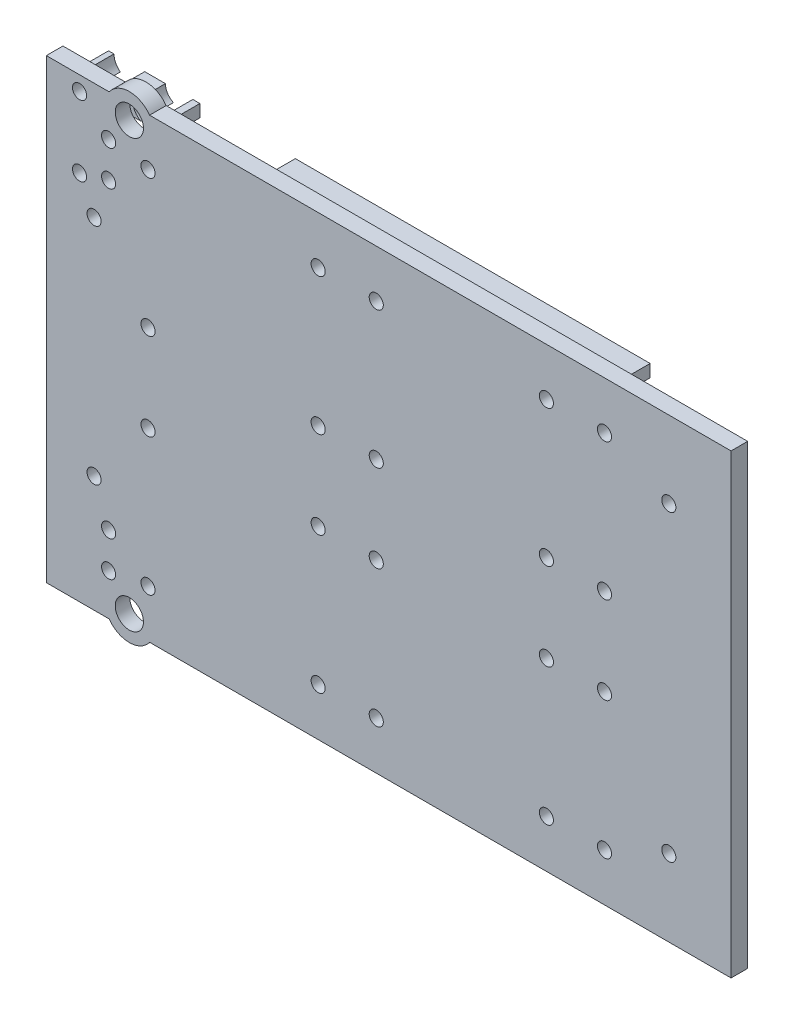
from build123d import *

# Parameters (mm, degrees)
MAIN_PROFILE_SKETCH_R       = 3.4
MAIN_PROFILE_SKETCH_R_2     = 1.7
MAIN_EXTRUSION_DEPTH        = 3.5
DETAIL_PROFILE_2_SKETCH_R   = 5.3
DETAIL_PROFILE_2_SKETCH_R_2 = 1.7
DETAIL_EXTRUSION_2_DEPTH    = 0.5
DETAIL_PROFILE_3_SKETCH_W   = 85.5
DETAIL_PROFILE_3_SKETCH_H   = 3
DETAIL_EXTRUSION_3_DEPTH    = 0.2
DETAIL_PROFILE_4_SKETCH_W   = 85.5
DETAIL_PROFILE_4_SKETCH_H   = 3
DETAIL_EXTRUSION_4_DEPTH    = 7.8


with BuildPart() as part:
    # Main Profile Sketch → Main Extrusion (new body)
    with BuildSketch(Plane.XY.offset(48.5)):
        with BuildLine():
            Line((-85.126602828, 55), (55, 55))
            Line((55, 55), (55, -55))
            Line((55, -55), (-85.126602828, -55))
            ThreePointArc((-85.126602828, -55), (-90, -57.5), (-94.873397172, -55))
            Line((-94.873397172, -55), (-110, -55))
            Line((-110, -55), (-110, 55))
            Line((-110, 55), (-94.873397172, 55))
            ThreePointArc((-94.873397172, 55), (-90, 57.5), (-85.126602828, 55))
        make_face()
        with Locations((-90, -51.5)):
            Circle(MAIN_PROFILE_SKETCH_R, mode=Mode.SUBTRACT)
        with Locations((-95, -45)):
            Circle(MAIN_PROFILE_SKETCH_R_2, mode=Mode.SUBTRACT)
        with Locations((-85.5, -43.5)):
            Circle(MAIN_PROFILE_SKETCH_R_2, mode=Mode.SUBTRACT)
        with Locations((-95, -36.5)):
            Circle(MAIN_PROFILE_SKETCH_R_2, mode=Mode.SUBTRACT)
        with Locations((-44.5, -43.5)):
            Circle(MAIN_PROFILE_SKETCH_R_2, mode=Mode.SUBTRACT)
        with Locations((-30.5, -43.5)):
            Circle(MAIN_PROFILE_SKETCH_R_2, mode=Mode.SUBTRACT)
        with Locations((-98.5, -27)):
            Circle(MAIN_PROFILE_SKETCH_R_2, mode=Mode.SUBTRACT)
        with Locations((-85.5, -10.5)):
            Circle(MAIN_PROFILE_SKETCH_R_2, mode=Mode.SUBTRACT)
        with Locations((-44.5, -10.5)):
            Circle(MAIN_PROFILE_SKETCH_R_2, mode=Mode.SUBTRACT)
        with Locations((-30.5, -10.5)):
            Circle(MAIN_PROFILE_SKETCH_R_2, mode=Mode.SUBTRACT)
        with Locations((10.5, -43.5)):
            Circle(MAIN_PROFILE_SKETCH_R_2, mode=Mode.SUBTRACT)
        with Locations((24.5, -43.5)):
            Circle(MAIN_PROFILE_SKETCH_R_2, mode=Mode.SUBTRACT)
        with Locations((40, -36.5)):
            Circle(MAIN_PROFILE_SKETCH_R_2, mode=Mode.SUBTRACT)
        with Locations((10.5, -10.5)):
            Circle(MAIN_PROFILE_SKETCH_R_2, mode=Mode.SUBTRACT)
        with Locations((24.5, -10.5)):
            Circle(MAIN_PROFILE_SKETCH_R_2, mode=Mode.SUBTRACT)
        with Locations((-85.5, 10.5)):
            Circle(MAIN_PROFILE_SKETCH_R_2, mode=Mode.SUBTRACT)
        with Locations((-98.5, 27)):
            Circle(MAIN_PROFILE_SKETCH_R_2, mode=Mode.SUBTRACT)
        with Locations((-44.5, 10.5)):
            Circle(MAIN_PROFILE_SKETCH_R_2, mode=Mode.SUBTRACT)
        with Locations((-30.5, 10.5)):
            Circle(MAIN_PROFILE_SKETCH_R_2, mode=Mode.SUBTRACT)
        with Locations((-102, 34.5)):
            Circle(MAIN_PROFILE_SKETCH_R_2, mode=Mode.SUBTRACT)
        with Locations((-95, 36.5)):
            Circle(MAIN_PROFILE_SKETCH_R_2, mode=Mode.SUBTRACT)
        with Locations((-95, 45)):
            Circle(MAIN_PROFILE_SKETCH_R_2, mode=Mode.SUBTRACT)
        with Locations((-102, 51.5)):
            Circle(MAIN_PROFILE_SKETCH_R_2, mode=Mode.SUBTRACT)
        with Locations((-90, 51.5)):
            Circle(MAIN_PROFILE_SKETCH_R, mode=Mode.SUBTRACT)
        with Locations((-85.5, 43.5)):
            Circle(MAIN_PROFILE_SKETCH_R_2, mode=Mode.SUBTRACT)
        with Locations((-44.5, 43.5)):
            Circle(MAIN_PROFILE_SKETCH_R_2, mode=Mode.SUBTRACT)
        with Locations((-30.5, 43.5)):
            Circle(MAIN_PROFILE_SKETCH_R_2, mode=Mode.SUBTRACT)
        with Locations((10.5, 10.5)):
            Circle(MAIN_PROFILE_SKETCH_R_2, mode=Mode.SUBTRACT)
        with Locations((24.5, 10.5)):
            Circle(MAIN_PROFILE_SKETCH_R_2, mode=Mode.SUBTRACT)
        with Locations((10.5, 43.5)):
            Circle(MAIN_PROFILE_SKETCH_R_2, mode=Mode.SUBTRACT)
        with Locations((40, 36.5)):
            Circle(MAIN_PROFILE_SKETCH_R_2, mode=Mode.SUBTRACT)
        with Locations((24.5, 43.5)):
            Circle(MAIN_PROFILE_SKETCH_R_2, mode=Mode.SUBTRACT)
    extrude(amount=-MAIN_EXTRUSION_DEPTH)

    # Detail Profile 2 Sketch → Detail Extrusion 2 (add)
    with BuildSketch(Plane.XY.offset(45)):
        with BuildLine():
            Line((-85.126602828, 55), (55, 55))
            Line((55, 55), (55, -55))
            Line((55, -55), (-85.126602828, -55))
            ThreePointArc((-85.126602828, -55), (-90, -57.5), (-94.873397172, -55))
            Line((-94.873397172, -55), (-110, -55))
            Line((-110, -55), (-110, 55))
            Line((-110, 55), (-94.873397172, 55))
            ThreePointArc((-94.873397172, 55), (-90, 57.5), (-85.126602828, 55))
        make_face()
        with Locations((-90, -51.5)):
            Circle(DETAIL_PROFILE_2_SKETCH_R, mode=Mode.SUBTRACT)
        with Locations((-95, -45)):
            Circle(DETAIL_PROFILE_2_SKETCH_R_2, mode=Mode.SUBTRACT)
        with Locations((-85.5, -43.5)):
            Circle(DETAIL_PROFILE_2_SKETCH_R_2, mode=Mode.SUBTRACT)
        with Locations((-95, -36.5)):
            Circle(DETAIL_PROFILE_2_SKETCH_R_2, mode=Mode.SUBTRACT)
        with Locations((-44.5, -43.5)):
            Circle(DETAIL_PROFILE_2_SKETCH_R_2, mode=Mode.SUBTRACT)
        with Locations((-30.5, -43.5)):
            Circle(DETAIL_PROFILE_2_SKETCH_R_2, mode=Mode.SUBTRACT)
        with Locations((-98.5, -27)):
            Circle(DETAIL_PROFILE_2_SKETCH_R_2, mode=Mode.SUBTRACT)
        with Locations((-85.5, -10.5)):
            Circle(DETAIL_PROFILE_2_SKETCH_R_2, mode=Mode.SUBTRACT)
        with Locations((-44.5, -10.5)):
            Circle(DETAIL_PROFILE_2_SKETCH_R_2, mode=Mode.SUBTRACT)
        with Locations((-30.5, -10.5)):
            Circle(DETAIL_PROFILE_2_SKETCH_R_2, mode=Mode.SUBTRACT)
        with Locations((10.5, -43.5)):
            Circle(DETAIL_PROFILE_2_SKETCH_R_2, mode=Mode.SUBTRACT)
        with Locations((24.5, -43.5)):
            Circle(DETAIL_PROFILE_2_SKETCH_R_2, mode=Mode.SUBTRACT)
        with Locations((40, -36.5)):
            Circle(DETAIL_PROFILE_2_SKETCH_R_2, mode=Mode.SUBTRACT)
        with Locations((10.5, -10.5)):
            Circle(DETAIL_PROFILE_2_SKETCH_R_2, mode=Mode.SUBTRACT)
        with Locations((24.5, -10.5)):
            Circle(DETAIL_PROFILE_2_SKETCH_R_2, mode=Mode.SUBTRACT)
        with Locations((-85.5, 10.5)):
            Circle(DETAIL_PROFILE_2_SKETCH_R_2, mode=Mode.SUBTRACT)
        with Locations((-98.5, 27)):
            Circle(DETAIL_PROFILE_2_SKETCH_R_2, mode=Mode.SUBTRACT)
        with Locations((-44.5, 10.5)):
            Circle(DETAIL_PROFILE_2_SKETCH_R_2, mode=Mode.SUBTRACT)
        with Locations((-30.5, 10.5)):
            Circle(DETAIL_PROFILE_2_SKETCH_R_2, mode=Mode.SUBTRACT)
        with Locations((-102, 34.5)):
            Circle(DETAIL_PROFILE_2_SKETCH_R_2, mode=Mode.SUBTRACT)
        with Locations((-95, 36.5)):
            Circle(DETAIL_PROFILE_2_SKETCH_R_2, mode=Mode.SUBTRACT)
        with Locations((-95, 45)):
            Circle(DETAIL_PROFILE_2_SKETCH_R_2, mode=Mode.SUBTRACT)
        with Locations((-102, 51.5)):
            Circle(DETAIL_PROFILE_2_SKETCH_R_2, mode=Mode.SUBTRACT)
        with Locations((-90, 51.5)):
            Circle(DETAIL_PROFILE_2_SKETCH_R, mode=Mode.SUBTRACT)
        with Locations((-85.5, 43.5)):
            Circle(DETAIL_PROFILE_2_SKETCH_R_2, mode=Mode.SUBTRACT)
        with Locations((-44.5, 43.5)):
            Circle(DETAIL_PROFILE_2_SKETCH_R_2, mode=Mode.SUBTRACT)
        with Locations((-30.5, 43.5)):
            Circle(DETAIL_PROFILE_2_SKETCH_R_2, mode=Mode.SUBTRACT)
        with Locations((10.5, 10.5)):
            Circle(DETAIL_PROFILE_2_SKETCH_R_2, mode=Mode.SUBTRACT)
        with Locations((24.5, 10.5)):
            Circle(DETAIL_PROFILE_2_SKETCH_R_2, mode=Mode.SUBTRACT)
        with Locations((10.5, 43.5)):
            Circle(DETAIL_PROFILE_2_SKETCH_R_2, mode=Mode.SUBTRACT)
        with Locations((40, 36.5)):
            Circle(DETAIL_PROFILE_2_SKETCH_R_2, mode=Mode.SUBTRACT)
        with Locations((24.5, 43.5)):
            Circle(DETAIL_PROFILE_2_SKETCH_R_2, mode=Mode.SUBTRACT)
    extrude(amount=-DETAIL_EXTRUSION_2_DEPTH)

    # Detail Profile 3 Sketch → Detail Extrusion 3 (add)
    with BuildSketch(Plane.XY.offset(44.5)):
        with BuildLine():
            Line((-107, -48.5), (-94.369210455, -48.5))
            ThreePointArc((-94.369210455, -48.5), (-95.061956905, -49.929461145), (-95.3, -51.5))
            Line((-95.3, -51.5), (-107, -51.5))
            Line((-107, -51.5), (-107, -48.5))
        make_face()
        with BuildLine():
            Line((-85.630789545, -48.5), (-85, -48.5))
            Line((-85, -48.5), (-85, -49.742160417))
            ThreePointArc((-85, -49.742160417), (-85.274403026, -49.100263923), (-85.630789545, -48.5))
        make_face()
        with Locations((-19.25, -50)):
            Rectangle(DETAIL_PROFILE_3_SKETCH_W, DETAIL_PROFILE_3_SKETCH_H)
        with BuildLine():
            Line((-107, 51.5), (-105.7, 51.5))
            ThreePointArc((-105.7, 51.5), (-105.294151704, 49.81519599), (-104.165640783, 48.5))
            Line((-104.165640783, 48.5), (-107, 48.5))
            Line((-107, 48.5), (-107, 51.5))
        make_face()
        with BuildLine():
            Line((-98.3, 51.5), (-95.3, 51.5))
            ThreePointArc((-95.3, 51.5), (-95.061956905, 49.929461145), (-94.369210455, 48.5))
            Line((-94.369210455, 48.5), (-99.834359217, 48.5))
            ThreePointArc((-99.834359217, 48.5), (-98.705848296, 49.81519599), (-98.3, 51.5))
        make_face()
        with BuildLine():
            Line((-85, 49.742160417), (-85, 48.5))
            Line((-85, 48.5), (-85.630789545, 48.5))
            ThreePointArc((-85.630789545, 48.5), (-85.274403026, 49.100263923), (-85, 49.742160417))
        make_face()
        with Locations((-19.25, 50)):
            Rectangle(DETAIL_PROFILE_3_SKETCH_W, DETAIL_PROFILE_3_SKETCH_H)
    extrude(amount=-DETAIL_EXTRUSION_3_DEPTH)

    # Detail Profile 4 Sketch → Detail Extrusion 4 (add)
    with BuildSketch(Plane.XY.offset(44.3)):
        with BuildLine():
            Line((-107, -48.5), (-91.374772708, -48.5))
            ThreePointArc((-91.374772708, -48.5), (-92.777296342, -49.717691096), (-93.3, -51.5))
            Line((-93.3, -51.5), (-107, -51.5))
            Line((-107, -51.5), (-107, -48.5))
        make_face()
        with BuildLine():
            Line((-85, -48.5), (-85, -51.5))
            Line((-85, -51.5), (-86.7, -51.5))
            ThreePointArc((-86.7, -51.5), (-87.222703658, -49.717691096), (-88.625227292, -48.5))
            Line((-88.625227292, -48.5), (-85, -48.5))
        make_face()
        with Locations((-19.25, -50)):
            Rectangle(DETAIL_PROFILE_4_SKETCH_W, DETAIL_PROFILE_4_SKETCH_H)
        with BuildLine():
            Line((-107, 51.5), (-105.7, 51.5))
            ThreePointArc((-105.7, 51.5), (-105.294151704, 49.81519599), (-104.165640783, 48.5))
            Line((-104.165640783, 48.5), (-107, 48.5))
            Line((-107, 48.5), (-107, 51.5))
        make_face()
        with BuildLine():
            Line((-98.3, 51.5), (-93.3, 51.5))
            ThreePointArc((-93.3, 51.5), (-92.777296342, 49.717691096), (-91.374772708, 48.5))
            Line((-91.374772708, 48.5), (-99.834359217, 48.5))
            ThreePointArc((-99.834359217, 48.5), (-98.705848296, 49.81519599), (-98.3, 51.5))
        make_face()
        with BuildLine():
            Line((-86.7, 51.5), (-85, 51.5))
            Line((-85, 51.5), (-85, 48.5))
            Line((-85, 48.5), (-88.625227292, 48.5))
            ThreePointArc((-88.625227292, 48.5), (-87.222703658, 49.717691096), (-86.7, 51.5))
        make_face()
        with Locations((-19.25, 50)):
            Rectangle(DETAIL_PROFILE_4_SKETCH_W, DETAIL_PROFILE_4_SKETCH_H)
    extrude(amount=-DETAIL_EXTRUSION_4_DEPTH)


solid = part.part
